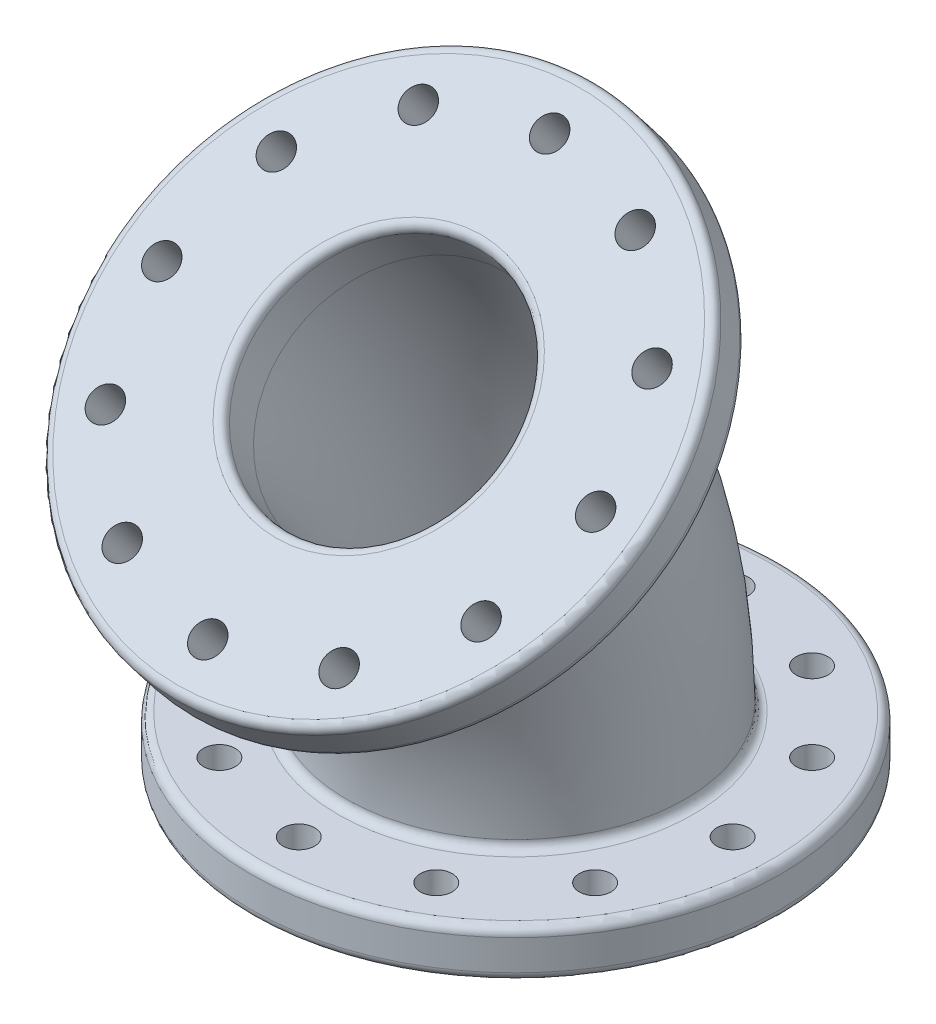
from build123d import *

# Parameters (mm, degrees)
SKETCH1_R               = 61
SKETCH1_R_2             = 3.665
SKETCH1_R_3             = 28
BOSS_EXTRUDE1_DEPTH     = 11
SWEEP_THIN1_PROFILE_R   = 39
SWEEP_THIN1_PROFILE_R_2 = 28
SKETCH21_R              = 61
SKETCH21_R_2            = 28
SKETCH21_R_3            = 3.665
BOSS_EXTRUDE2_DEPTH     = 11
FILLET1_R               = 2


with BuildPart() as part:
    # Sketch1 → Boss-Extrude1 (new body)
    with BuildSketch(Plane(origin=(0, 0, 0), x_dir=(1, 0, 0), z_dir=(0, 1, 0))):
        with Locations(Location((0, 0, 0), (0, 0, 270))):
            Circle(SKETCH1_R)
        with Locations(Location((-25, 43.301270189, 0), (0, 0, 270))):
            Circle(SKETCH1_R_2, mode=Mode.SUBTRACT)
        with Locations(Location((-43.301270189, 25, 0), (0, 0, 270))):
            Circle(SKETCH1_R_2, mode=Mode.SUBTRACT)
        with Locations(Location((-50, 0, 0), (0, 0, 270))):
            Circle(SKETCH1_R_2, mode=Mode.SUBTRACT)
        with Locations(Location((-43.301270189, -25, 0), (0, 0, 270))):
            Circle(SKETCH1_R_2, mode=Mode.SUBTRACT)
        with Locations(Location((-25, -43.301270189, 0), (0, 0, 270))):
            Circle(SKETCH1_R_2, mode=Mode.SUBTRACT)
        with Locations(Location((0, -50, 0), (0, 0, 270))):
            Circle(SKETCH1_R_2, mode=Mode.SUBTRACT)
        with Locations(Location((25, -43.301270189, 0), (0, 0, 270))):
            Circle(SKETCH1_R_2, mode=Mode.SUBTRACT)
        with Locations(Location((43.301270189, -25, 0), (0, 0, 270))):
            Circle(SKETCH1_R_2, mode=Mode.SUBTRACT)
        with Locations(Location((50, 0, 0), (0, 0, 270))):
            Circle(SKETCH1_R_2, mode=Mode.SUBTRACT)
        with Locations(Location((43.301270189, 25, 0), (0, 0, 270))):
            Circle(SKETCH1_R_2, mode=Mode.SUBTRACT)
        with Locations(Location((25, 43.301270189, 0), (0, 0, 270))):
            Circle(SKETCH1_R_2, mode=Mode.SUBTRACT)
        with Locations(Location((0, 50, 0), (0, 0, 270))):
            Circle(SKETCH1_R_2, mode=Mode.SUBTRACT)
        with Locations(Location((0, 0, 0), (0, 0, 270))):
            Circle(SKETCH1_R_3, mode=Mode.SUBTRACT)
    extrude(amount=BOSS_EXTRUDE1_DEPTH)

    # Sweep-Thin1: sweep along a path in Sketch2
    with BuildLine(Plane(origin=(0, 0, 0), x_dir=(0, 0, -1), z_dir=(1, 0, 0))) as sweep_thin1_path:
        ThreePointArc((0, 11), (-6.374326655, 49.091474071), (-24.802741828, 83.032392613))
    # Sweep-Thin1 profile (on start of the path) → Sweep-Thin1 (sweep)
    with BuildSketch(Plane.ZX.offset(11)):
        Circle(SWEEP_THIN1_PROFILE_R)
        Circle(SWEEP_THIN1_PROFILE_R_2, mode=Mode.SUBTRACT)
    sweep(path=sweep_thin1_path.line)

    # Sketch21 → Boss-Extrude2 (add)
    with BuildSketch(Plane(origin=(0, 63.592870413, 49.684195602), x_dir=(1, 0, 0), z_dir=(0, 0.7880107536067255, 0.6156614753256537))):
        with Locations(Location((0, 31.575018057, 0), (0, 0, 270))):
            Circle(SKETCH21_R)
        with Locations(Location((0, 31.575018057, 0), (0, 0, 90))):
            Circle(SKETCH21_R_2, mode=Mode.SUBTRACT)
        with Locations(Location((0, 81.575018057, 0), (0, 0, 270))):
            Circle(SKETCH21_R_3, mode=Mode.SUBTRACT)
        with Locations(Location((25, 74.876288246, 0), (0, 0, 270))):
            Circle(SKETCH21_R_3, mode=Mode.SUBTRACT)
        with Locations(Location((43.301270189, 56.575018057, 0), (0, 0, 270))):
            Circle(SKETCH21_R_3, mode=Mode.SUBTRACT)
        with Locations(Location((50, 31.575018057, 0), (0, 0, 270))):
            Circle(SKETCH21_R_3, mode=Mode.SUBTRACT)
        with Locations(Location((43.301270189, 6.575018057, 0), (0, 0, 270))):
            Circle(SKETCH21_R_3, mode=Mode.SUBTRACT)
        with Locations(Location((25, -11.726252133, 0), (0, 0, 270))):
            Circle(SKETCH21_R_3, mode=Mode.SUBTRACT)
        with Locations(Location((0, -18.424981943, 0), (0, 0, 270))):
            Circle(SKETCH21_R_3, mode=Mode.SUBTRACT)
        with Locations(Location((-25, -11.726252133, 0), (0, 0, 270))):
            Circle(SKETCH21_R_3, mode=Mode.SUBTRACT)
        with Locations(Location((-43.301270189, 6.575018057, 0), (0, 0, 270))):
            Circle(SKETCH21_R_3, mode=Mode.SUBTRACT)
        with Locations(Location((-50, 31.575018057, 0), (0, 0, 270))):
            Circle(SKETCH21_R_3, mode=Mode.SUBTRACT)
        with Locations(Location((-43.301270189, 56.575018057, 0), (0, 0, 270))):
            Circle(SKETCH21_R_3, mode=Mode.SUBTRACT)
        with Locations(Location((-25, 74.876288246, 0), (0, 0, 270))):
            Circle(SKETCH21_R_3, mode=Mode.SUBTRACT)
    extrude(amount=BOSS_EXTRUDE2_DEPTH)

    # Fillet1
    fillet1_edges = [part.edges().sort_by_distance(p)[0] for p in [
        (0, 0, -61),
        (0, 0, -28),
        (0, 11, -39),
        (0, 107.043190151, -5.929677563),
        (0, 129.255860898, -16.493637913),
        (0, 120.587742608, -23.265914142),
        (0, 74.461989594, 53.639319158),
        (0, 11, -61),
    ]]
    fillet(fillet1_edges, radius=FILLET1_R)


solid = part.part
